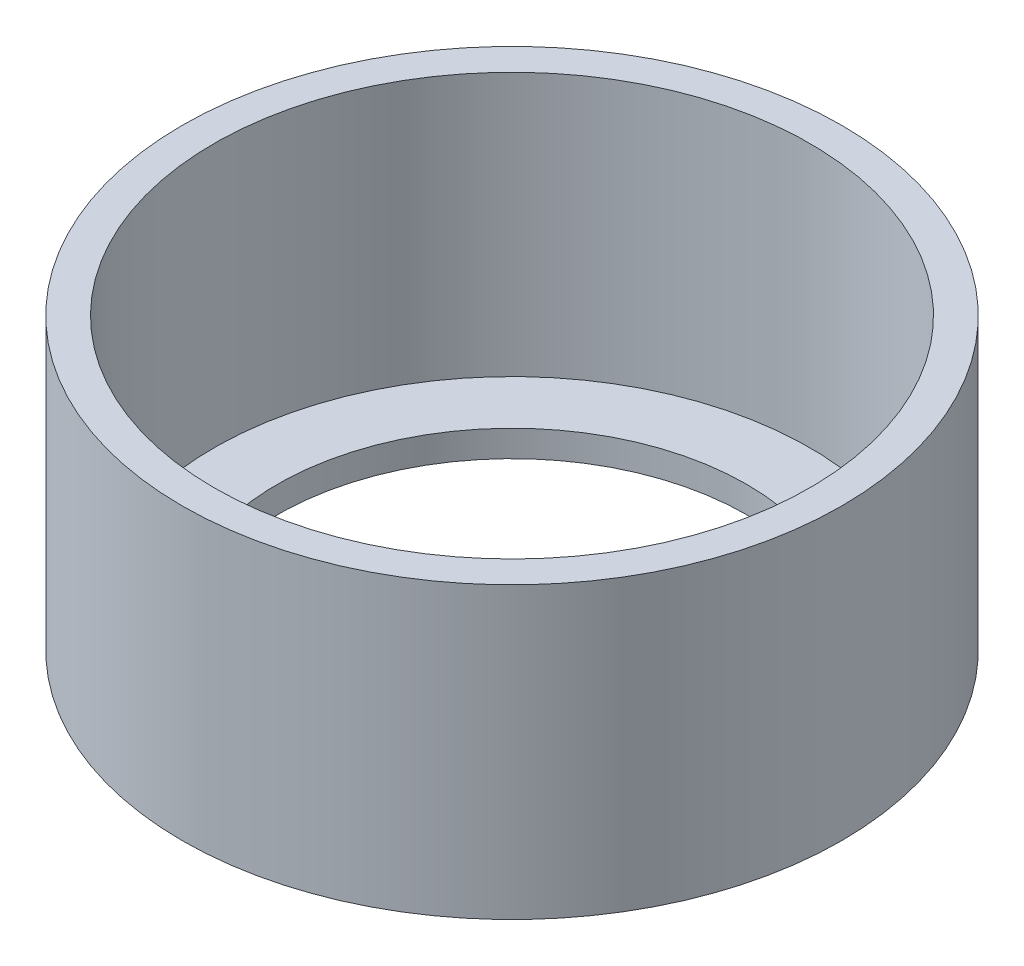
from build123d import *

# Parameters (mm, degrees)
CROQUIS1_R              = 6.255
CROQUIS1_R_2            = 5.655
SALIENTE_EXTRUIR1_DEPTH = 5
SALIENTE_EXTRUIR2_START = 0.5
CROQUIS2_R              = 6.255
CROQUIS2_R_2            = 4.455
SALIENTE_EXTRUIR2_DEPTH = 0.5


with BuildPart() as part:
    # Croquis1 → Saliente-Extruir1 (new body)
    with BuildSketch(Plane(origin=(0, 0, 0), x_dir=(1, 0, 0), z_dir=(0, 1, 0))):
        with Locations(Location((0, 0, 0), (0, 0, 270))):
            Circle(CROQUIS1_R)
        with Locations(Location((0, 0, 0), (0, 0, 270))):
            Circle(CROQUIS1_R_2, mode=Mode.SUBTRACT)
    extrude(amount=SALIENTE_EXTRUIR1_DEPTH)

    # Croquis2 → Saliente-Extruir2 (add)
    with BuildSketch(Plane.XZ.offset(SALIENTE_EXTRUIR2_START)):
        with Locations(Location((0, 0, 0), (0, 0, 270))):
            Circle(CROQUIS2_R)
        with Locations(Location((0, 0, 0), (0, 0, 270))):
            Circle(CROQUIS2_R_2, mode=Mode.SUBTRACT)
    extrude(amount=-SALIENTE_EXTRUIR2_DEPTH)


solid = part.part
